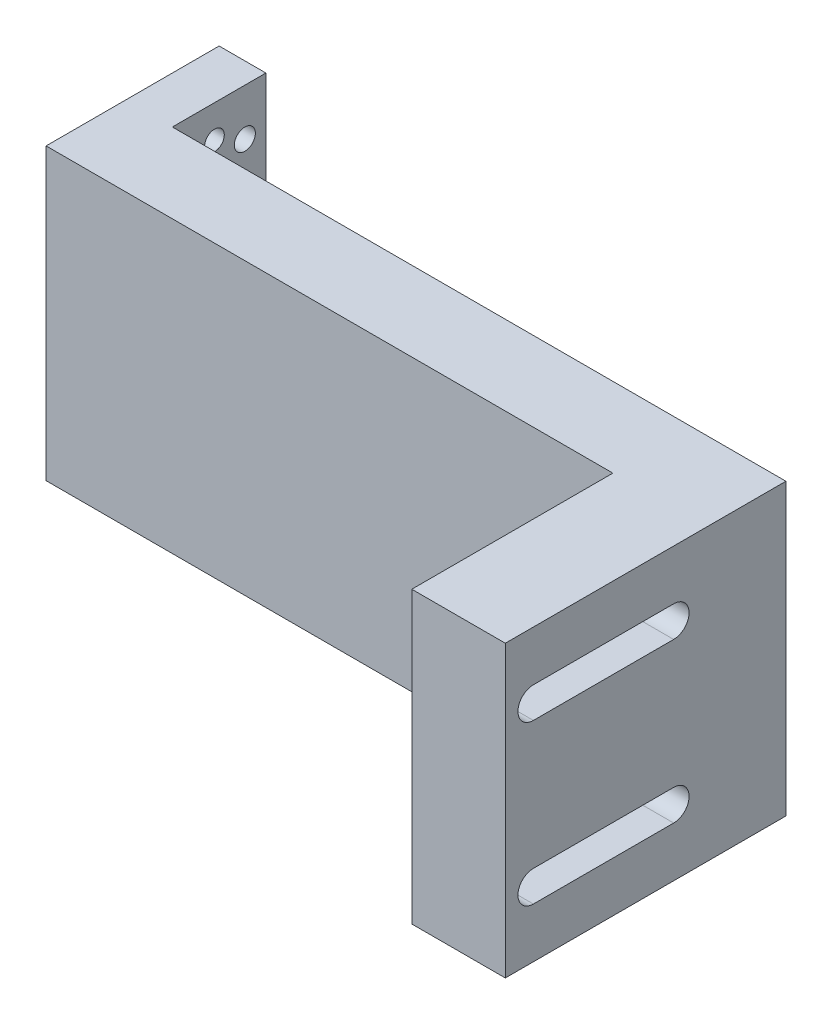
from build123d import *

# Parameters (mm, degrees)
SKETCH_1_W             = 141.2
SKETCH_1_H             = 62
EXTRUDE_1_DEPTH        = 80
SKETCH_2_W             = 131.2
SKETCH_2_H             = 20
SKETCH_2_W_2           = 121.2
SKETCH_2_H_2           = 43
CUT_EXTRUDE_1_DEPTH    = 174.728063363
CUT_EXTRUDE_2_DEPTH    = 70
SKETCH_4_R             = 2.25
CUT_EXTRUDE_3_DEPTH    = 166.702866602
HOLE_WIZARD_M5_1_D     = 4.2
HOLE_WIZARD_M5_1_DEPTH = 12.4
HOLE_WIZARD_M5_1_TIP   = 1.2618073


with BuildPart() as part:
    # 草图1 → 凸台-拉伸1 (new body)
    with BuildSketch(Plane.XY):
        with Locations((70.6, 31)):
            Rectangle(SKETCH_1_W, SKETCH_1_H)
    extrude(amount=EXTRUDE_1_DEPTH)

    # 草图2 → 切除-拉伸1 (cut, through all)
    with BuildSketch(Plane.XZ):
        with Locations((75.6, 10)):
            Rectangle(SKETCH_2_W, SKETCH_2_H)
        with Locations((60.6, 58.5)):
            Rectangle(SKETCH_2_W_2, SKETCH_2_H_2)
    extrude(amount=-CUT_EXTRUDE_1_DEPTH, mode=Mode.SUBTRACT)

    # 草图3 → 切除-拉伸2 (cut)
    with BuildSketch(Plane.ZY.offset(-121.2)):
        with BuildLine():
            Line((44, 17.3), (74, 17.3))
            ThreePointArc((74, 17.3), (77.3, 14), (74, 10.7))
            Line((74, 10.7), (44, 10.7))
            ThreePointArc((44, 10.7), (40.7, 14), (44, 17.3))
        make_face()
        with BuildLine():
            Line((44, 44.7), (74, 44.7))
            ThreePointArc((74, 44.7), (77.3, 48), (74, 51.3))
            Line((74, 51.3), (44, 51.3))
            ThreePointArc((44, 51.3), (40.7, 48), (44, 44.7))
        make_face()
    extrude(amount=-CUT_EXTRUDE_2_DEPTH, mode=Mode.SUBTRACT)

    # 草图4 → 切除-拉伸3 (cut, through all)
    with BuildSketch(Plane(origin=(10, 0, 0), x_dir=(0, 0, -1), z_dir=(1, 0, 0))):
        with Locations(Location((-4.5, 10, 0), (0, 0, 180))):
            Circle(SKETCH_4_R)
        with Locations((-4.5, 52)):
            Circle(SKETCH_4_R)
    extrude(amount=-CUT_EXTRUDE_3_DEPTH, mode=Mode.SUBTRACT)

    # M5 螺纹孔1
    with Locations(Plane.ZY):
        with Locations((29, 7), (11, 7), (11, 55), (29, 55)):
            Hole(HOLE_WIZARD_M5_1_D / 2, depth=HOLE_WIZARD_M5_1_DEPTH)
            with Locations((0, 0, -(HOLE_WIZARD_M5_1_DEPTH + HOLE_WIZARD_M5_1_TIP / 2))):  # 118° drill point
                Cone(0, HOLE_WIZARD_M5_1_D / 2, HOLE_WIZARD_M5_1_TIP, mode=Mode.SUBTRACT)


solid = part.part
